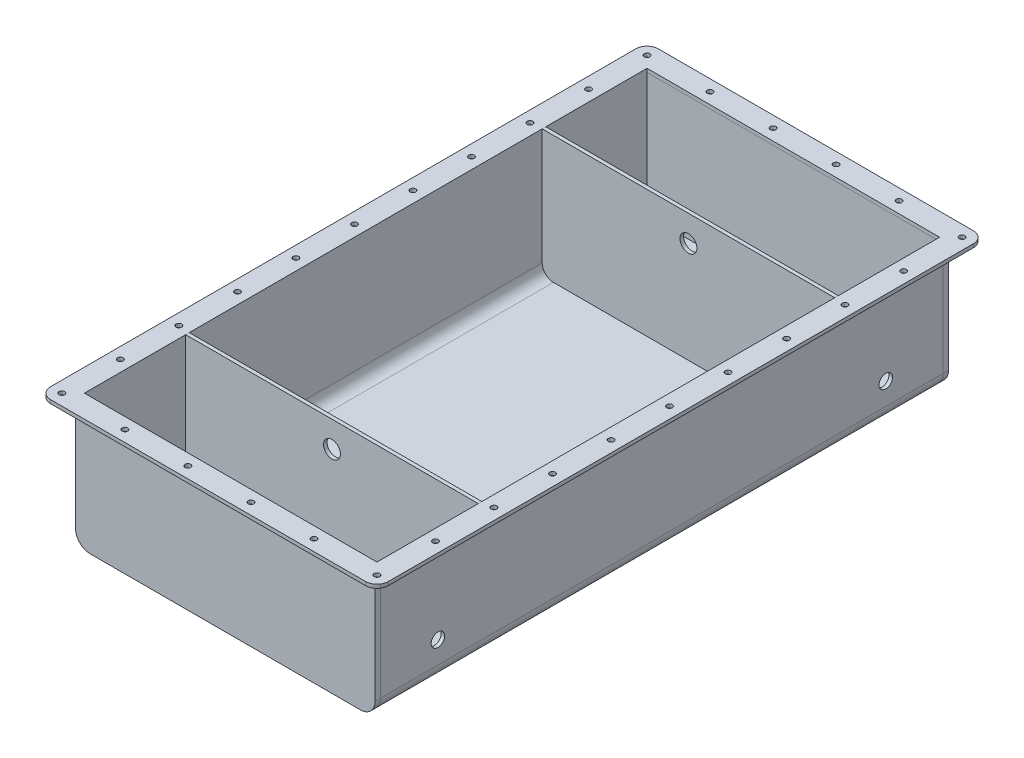
from build123d import *

# Parameters (mm, degrees)
INTERIOR_DIM_DEPTH      = 500
FILLET2_R               = 10
FILLET3_R               = 13.175
ENDCAP1_DEPTH           = 4.7625
COMPARTMENT1_BOSS_DEPTH = 3.175
SKETCH9_W               = 300
SKETCH9_H               = 540
SKETCH9_W_2             = 260
SKETCH9_H_2             = 500
LID_FLANGE_DEPTH        = 3.175
FILLET4_R               = 10
ENDCAP2_DEPTH           = 4.7625
COMPARTMENT2_BOSS_DEPTH = 3.175
SKETCH16_R              = 6
BEARING_HOLES_DEPTH     = 603.823905672
WIRE_PASSTHROUGH_START  = -320
SKETCH17_R              = 7.5
WIRE_PASSTHROUGH_DEPTH  = 320
SKETCH18_W              = 260
SKETCH18_H              = 3.175
BOSS_EXTRUDE1_DEPTH     = 3.18
SKETCH20_R              = 2.5
BOLT_HOLES_DEPTH        = 3.175


with BuildPart() as part:
    # Sketch2 → Interior Dim (new body)
    with BuildSketch(Plane.XY):
        Polygon((-130, 0), (130, 0), (130, 110), (133.175, 110), (133.175, -3.175), (-133.175, -3.175), (-133.175, 110), (-130, 110), align=None)
    extrude(amount=-INTERIOR_DIM_DEPTH)

    # Fillet2
    fillet2_edges = [part.edges().sort_by_distance(p)[0] for p in [
        (-130, 0, -250),
        (130, 0, -250),
    ]]
    fillet(fillet2_edges, radius=FILLET2_R)

    # Fillet3
    fillet3_edges = [part.edges().sort_by_distance(p)[0] for p in [
        (-133.175, -3.175, -250),
        (133.175, -3.175, -250),
    ]]
    fillet(fillet3_edges, radius=FILLET3_R)



with BuildPart() as body_2:
    # Sketch4 → Endcap1 (new body)
    with BuildSketch(Plane.XY):
        with BuildLine():
            Line((-130, 110), (130, 110))
            Line((130, 110), (133.175, 110))
            Line((133.175, 110), (133.175, 10))
            ThreePointArc((133.175, 10), (129.316131842, 0.683868158), (120, -3.175))
            Line((120, -3.175), (-120, -3.175))
            ThreePointArc((-120, -3.175), (-129.316131842, 0.683868158), (-133.175, 10))
            Line((-133.175, 10), (-133.175, 110))
            Line((-133.175, 110), (-130, 110))
        make_face()
    extrude(amount=ENDCAP1_DEPTH)


with BuildPart() as body_3:
    # Sketch7 → Compartment1_Boss (new body)
    with BuildSketch(Plane(origin=(0, 0, -90), x_dir=(-1, 0, 0), z_dir=(0, 0, -1))):
        with BuildLine():
            Line((120, 0), (-120, 0))
            ThreePointArc((-120, 0), (-127.071067812, 2.928932188), (-130, 10))
            Line((-130, 10), (-130, 110))
            Line((-130, 110), (130, 110))
            Line((130, 110), (130, 10))
            ThreePointArc((130, 10), (127.071067812, 2.928932188), (120, 0))
        make_face()
    extrude(amount=COMPARTMENT1_BOSS_DEPTH)


with BuildPart() as body_4:
    # Sketch9 → Lid_Flange (new body)
    with BuildSketch(Plane(origin=(0, 110, 0), x_dir=(1, 0, 0), z_dir=(0, 1, 0))):
        with Locations((0, 250)):
            Rectangle(SKETCH9_W, SKETCH9_H)
        with Locations((0, 250)):
            Rectangle(SKETCH9_W_2, SKETCH9_H_2, mode=Mode.SUBTRACT)
    extrude(amount=LID_FLANGE_DEPTH)

    # Fillet4
    fillet4_edges = [body_4.edges().sort_by_distance(p)[0] for p in [
        (150, 111.5875, -520),
        (150, 111.5875, 20),
        (-150, 111.5875, 20),
        (-150, 111.5875, -520),
    ]]
    fillet(fillet4_edges, radius=FILLET4_R)


with BuildPart() as body_5:
    # Sketch5 → Endcap2 (new body)
    with BuildSketch(Plane(origin=(0, 0, -500), x_dir=(-1, 0, 0), z_dir=(0, 0, -1))):
        with BuildLine():
            Line((133.175, 110), (-133.175, 110))
            Line((-133.175, 110), (-133.175, 10))
            ThreePointArc((-133.175, 10), (-129.316131842, 0.683868158), (-120, -3.175))
            Line((-120, -3.175), (120, -3.175))
            ThreePointArc((120, -3.175), (129.316131842, 0.683868158), (133.175, 10))
            Line((133.175, 10), (133.175, 110))
        make_face()
    extrude(amount=ENDCAP2_DEPTH)


with BuildPart() as part_1:
    add(part.part)

    add(body_4.part)  # Compartment2_Boss merges body 4
    # Sketch13 → Compartment2_Boss (add)
    with BuildSketch(Plane.XY.offset(-410)):
        with BuildLine():
            Line((130, 110), (-130, 110))
            Line((-130, 110), (-130, 10))
            ThreePointArc((-130, 10), (-127.071067812, 2.928932188), (-120, 0))
            Line((-120, 0), (120, 0))
            ThreePointArc((120, 0), (127.071067812, 2.928932188), (130, 10))
            Line((130, 10), (130, 110))
        make_face()
    extrude(amount=COMPARTMENT2_BOSS_DEPTH)

    # Sketch16 → Bearing_holes (cut, through all)
    with BuildSketch(Plane.ZY.offset(133.175)):
        with Locations(Location((-449, 29.5, 0), (0, 0, 270))):
            Circle(SKETCH16_R)
        with Locations(Location((-51, 29.5, 0), (0, 0, 270))):
            Circle(SKETCH16_R)
    extrude(amount=-BEARING_HOLES_DEPTH, mode=Mode.SUBTRACT)


with BuildPart() as wire_passthrough_tool:
    # Sketch17 → Wire_Passthrough (new body)
    with BuildSketch(Plane(origin=(0, 0, -410), x_dir=(-1, 0, 0), z_dir=(0, 0, -1)).offset(WIRE_PASSTHROUGH_START)):
        with Locations((0, 90)):
            Circle(SKETCH17_R)
    extrude(amount=WIRE_PASSTHROUGH_DEPTH)


with BuildPart() as part_2:
    add(part_1.part)

    # Wire_Passthrough: cut by wire_passthrough_tool
    add(wire_passthrough_tool.part, mode=Mode.SUBTRACT)



with BuildPart() as body_3_1:
    add(body_3.part)

    # Wire_Passthrough: cut by wire_passthrough_tool
    add(wire_passthrough_tool.part, mode=Mode.SUBTRACT)


with BuildPart() as part_3:
    add(part_2.part)

    add(body_3_1.part)  # Boss-Extrude1 merges body 3
    # Sketch18 → Boss-Extrude1 (add)
    with BuildSketch(Plane(origin=(0, 110, 0), x_dir=(1, 0, 0), z_dir=(0, 1, 0))):
        with Locations((0, 408.4125)):
            Rectangle(SKETCH18_W, SKETCH18_H)
        with Locations((0, 91.5875)):
            Rectangle(SKETCH18_W, SKETCH18_H)
    extrude(amount=BOSS_EXTRUDE1_DEPTH)

    # Sketch20 → Bolt_Holes (cut)
    with BuildSketch(Plane(origin=(0, 110, 175), x_dir=(1, 0, 0), z_dir=(0, 1, 0))):
        with Locations(Location((-140, 165, 0), (0, 0, 270))):
            Circle(SKETCH20_R)
        with Locations(Location((-140, 217, 0), (0, 0, 270))):
            Circle(SKETCH20_R)
        with Locations(Location((-140, 269, 0), (0, 0, 270))):
            Circle(SKETCH20_R)
        with Locations(Location((-140, 321, 0), (0, 0, 270))):
            Circle(SKETCH20_R)
        with Locations(Location((-140, 373, 0), (0, 0, 270))):
            Circle(SKETCH20_R)
        with Locations(Location((-140, 425, 0), (0, 0, 270))):
            Circle(SKETCH20_R)
        with Locations(Location((-140, 477, 0), (0, 0, 270))):
            Circle(SKETCH20_R)
        with Locations(Location((-140, 529, 0), (0, 0, 270))):
            Circle(SKETCH20_R)
        with Locations(Location((-140, 581, 0), (0, 0, 270))):
            Circle(SKETCH20_R)
        with Locations(Location((-140, 633, 0), (0, 0, 270))):
            Circle(SKETCH20_R)
        with Locations(Location((-140, 685, 0), (0, 0, 270))):
            Circle(SKETCH20_R)
        with Locations(Location((-84, 685, 0), (0, 0, 270))):
            Circle(SKETCH20_R)
        with Locations(Location((-28, 685, 0), (0, 0, 270))):
            Circle(SKETCH20_R)
        with Locations(Location((28, 685, 0), (0, 0, 270))):
            Circle(SKETCH20_R)
        with Locations(Location((84, 685, 0), (0, 0, 270))):
            Circle(SKETCH20_R)
        with Locations(Location((140, 685, 0), (0, 0, 270))):
            Circle(SKETCH20_R)
        with Locations(Location((140, 633, 0), (0, 0, 270))):
            Circle(SKETCH20_R)
        with Locations(Location((140, 581, 0), (0, 0, 270))):
            Circle(SKETCH20_R)
        with Locations(Location((140, 529, 0), (0, 0, 270))):
            Circle(SKETCH20_R)
        with Locations(Location((140, 477, 0), (0, 0, 270))):
            Circle(SKETCH20_R)
        with Locations(Location((140, 425, 0), (0, 0, 270))):
            Circle(SKETCH20_R)
        with Locations(Location((140, 373, 0), (0, 0, 270))):
            Circle(SKETCH20_R)
        with Locations(Location((140, 321, 0), (0, 0, 270))):
            Circle(SKETCH20_R)
        with Locations(Location((140, 269, 0), (0, 0, 270))):
            Circle(SKETCH20_R)
        with Locations(Location((140, 217, 0), (0, 0, 270))):
            Circle(SKETCH20_R)
        with Locations(Location((140, 165, 0), (0, 0, 270))):
            Circle(SKETCH20_R)
        with Locations(Location((84, 165, 0), (0, 0, 270))):
            Circle(SKETCH20_R)
        with Locations(Location((28, 165, 0), (0, 0, 270))):
            Circle(SKETCH20_R)
        with Locations(Location((-28, 165, 0), (0, 0, 270))):
            Circle(SKETCH20_R)
        with Locations(Location((-84, 165, 0), (0, 0, 270))):
            Circle(SKETCH20_R)
    extrude(amount=BOLT_HOLES_DEPTH, mode=Mode.SUBTRACT)


solid = Compound([body_2.part, body_5.part, part_3.part])
